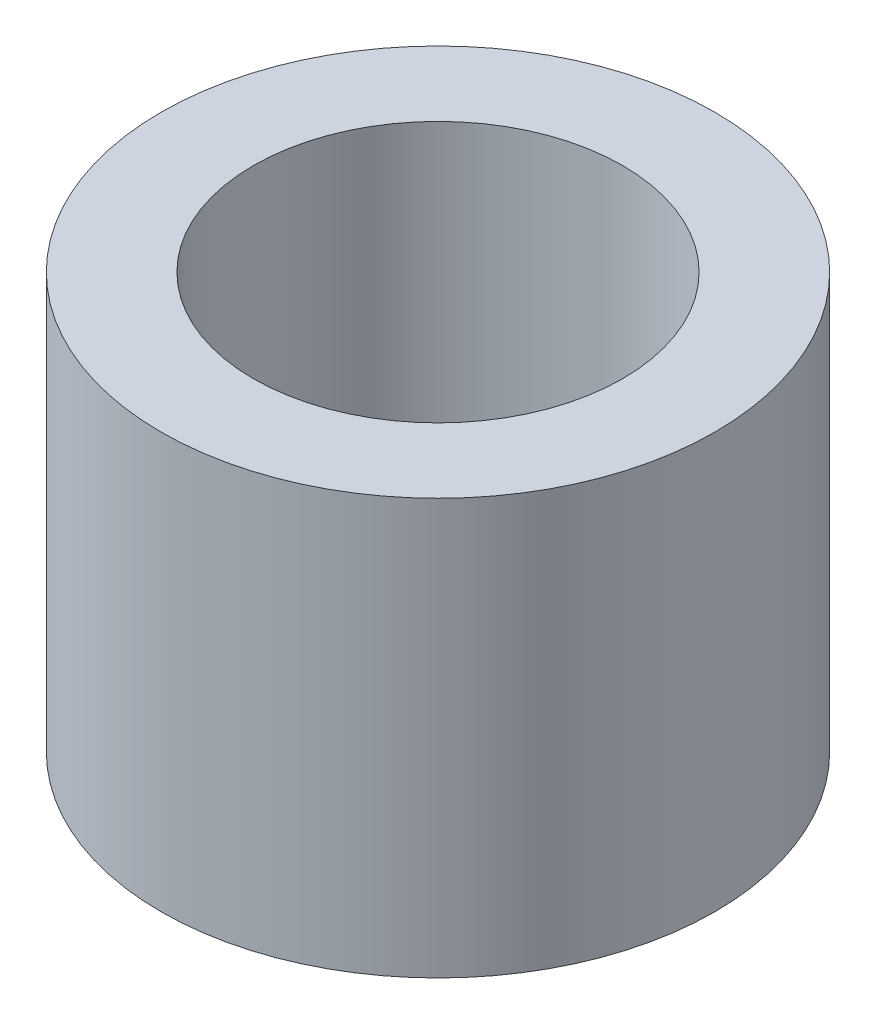
from build123d import *

# Parameters (mm, degrees)
SKETCH1_R           = 3
BOSS_EXTRUDE1_DEPTH = 4.5
SKETCH2_R           = 2
CUT_EXTRUDE1_DEPTH  = 7.184658438


with BuildPart() as part:
    # Sketch1 → Boss-Extrude1 (new body)
    with BuildSketch(Plane(origin=(0, 0, 0), x_dir=(1, 0, 0), z_dir=(0, 1, 0))):
        with Locations(Location((0, 0, 0), (0, 0, 270))):
            Circle(SKETCH1_R)
    extrude(amount=BOSS_EXTRUDE1_DEPTH)

    # Sketch2 → Cut-Extrude1 (cut, through all)
    with BuildSketch(Plane(origin=(0, 4.5, 0), x_dir=(1, 0, 0), z_dir=(0, 1, 0))):
        with Locations(Location((0, 0, 0), (0, 0, 270))):
            Circle(SKETCH2_R)
    extrude(amount=-CUT_EXTRUDE1_DEPTH, mode=Mode.SUBTRACT)


solid = part.part
